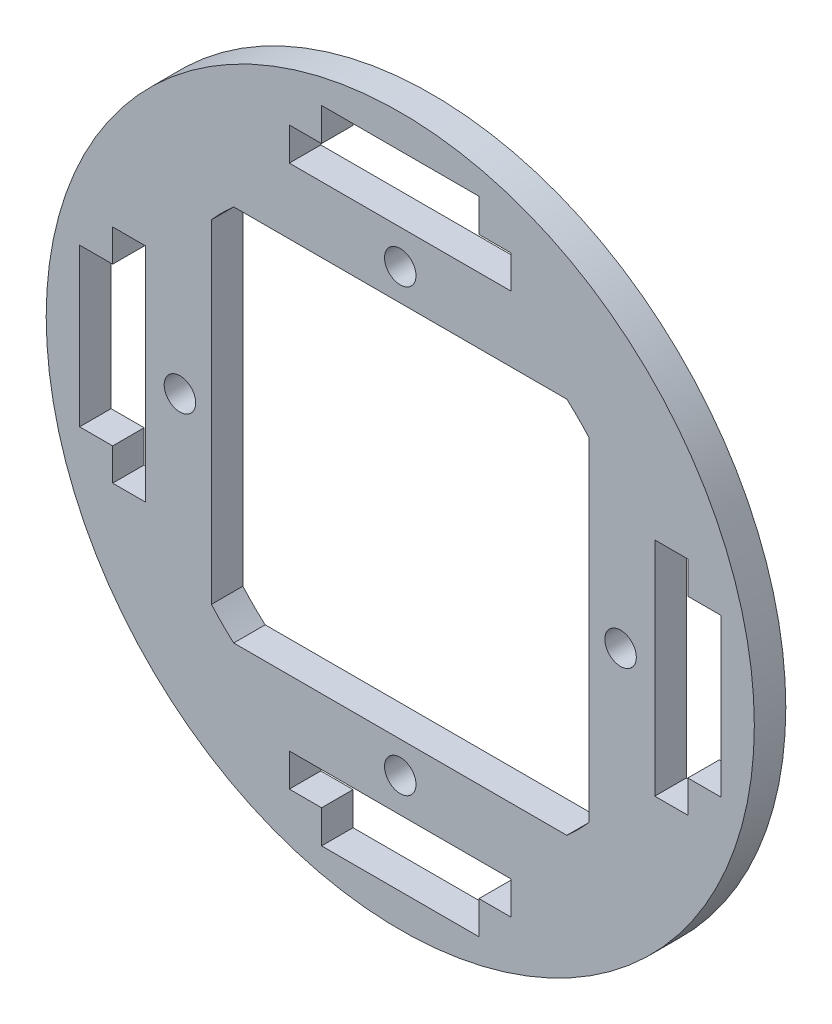
from build123d import *

# Parameters (mm, degrees)
SKETCH_1_R      = 22.5
EXTRUDE_1_DEPTH = 2
MM_1_D          = 2
MM_1_DEPTH      = 5.2
MM_1_TIP        = 0.600860619


with BuildPart() as part:
    # 草图1 → 凸台-拉伸1 (new body)
    with BuildSketch(Plane.XY):
        Circle(SKETCH_1_R)
        with BuildLine():
            Line((10.583005244, -12), (-10.583005244, -12))
            ThreePointArc((-10.583005244, -12), (-11.313708499, -11.313708499), (-12, -10.583005244))
            Line((-12, -10.583005244), (-12, 10.583005244))
            ThreePointArc((-12, 10.583005244), (-11.313708499, 11.313708499), (-10.583005244, 12))
            Line((-10.583005244, 12), (10.583005244, 12))
            ThreePointArc((10.583005244, 12), (11.313708499, 11.313708499), (12, 10.583005244))
            Line((12, 10.583005244), (12, -10.583005244))
            ThreePointArc((12, -10.583005244), (11.313708499, -11.313708499), (10.583005244, -12))
        make_face(mode=Mode.SUBTRACT)
        Polygon((-5, 18.275), (-5, 20.375), (5, 20.375), (5, 18.275), (7.05, 18.275), (7.05, 16.175), (-7.05, 16.175), (-7.05, 18.275), align=None, mode=Mode.SUBTRACT)
        Polygon((-18.275, 7.05), (-16.175, 7.05), (-16.175, -7.05), (-18.275, -7.05), (-18.275, -5), (-20.375, -5), (-20.375, 5), (-18.275, 5), align=None, mode=Mode.SUBTRACT)
        Polygon((-7.05, -18.275), (-7.05, -16.175), (7.05, -16.175), (7.05, -18.275), (5, -18.275), (5, -20.375), (-5, -20.375), (-5, -18.275), align=None, mode=Mode.SUBTRACT)
        Polygon((18.275, -7.05), (16.175, -7.05), (16.175, 7.05), (18.275, 7.05), (18.275, 5), (20.375, 5), (20.375, -5), (18.275, -5), align=None, mode=Mode.SUBTRACT)
    extrude(amount=EXTRUDE_1_DEPTH)

    # 大小mm 暗销孔1
    with Locations(Plane.XY.offset(2)):
        with Locations((0, 14), (-14, 0), (0, -14), (14, 0)):
            Hole(MM_1_D / 2, depth=MM_1_DEPTH)
            with Locations((0, 0, -(MM_1_DEPTH + MM_1_TIP / 2))):  # 118° drill point
                Cone(0, MM_1_D / 2, MM_1_TIP, mode=Mode.SUBTRACT)


solid = part.part
